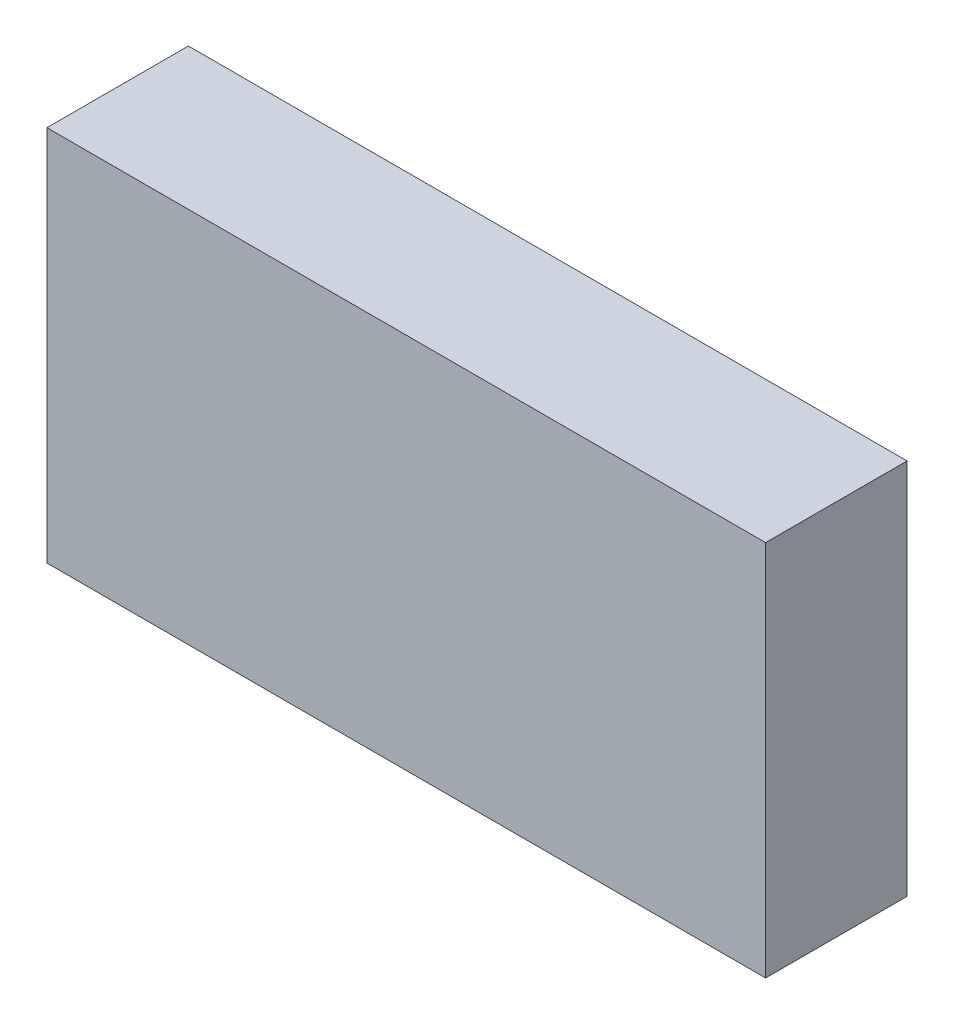
from build123d import *

# Parameters (mm, degrees)
SKETCH1_W           = 101.6
SKETCH1_H           = 53.3
BOSS_EXTRUDE1_DEPTH = 20


with BuildPart() as part:
    # Sketch1 → Boss-Extrude1 (new body)
    with BuildSketch(Plane.XY):
        with Locations((50.8, 26.65)):
            Rectangle(SKETCH1_W, SKETCH1_H)
    extrude(amount=BOSS_EXTRUDE1_DEPTH)


solid = part.part
